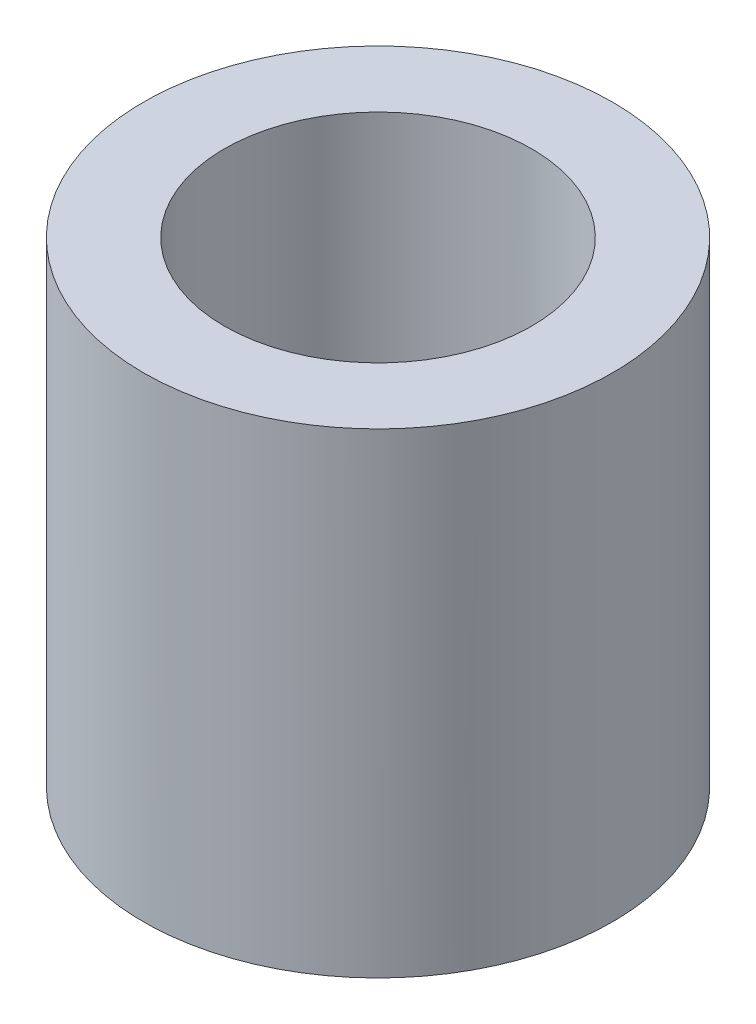
from build123d import *

# Parameters (mm, degrees)
SKETCH1_R           = 29
SKETCH1_R_2         = 19
BOSS_EXTRUDE1_DEPTH = 58.8
SKETCH2_R           = 10.45
CUT_EXTRUDE1_DEPTH  = 72.689887711


with BuildPart() as part:
    # Sketch1 → Boss-Extrude1 (new body)
    with BuildSketch(Plane(origin=(0, 0, 0), x_dir=(1, 0, 0), z_dir=(0, 1, 0))):
        with Locations(Location((0, 0, 0), (0, 0, 270))):
            Circle(SKETCH1_R)
        with Locations(Location((0, 0, 0), (0, 0, 270))):
            Circle(SKETCH1_R_2, mode=Mode.SUBTRACT)
    extrude(amount=BOSS_EXTRUDE1_DEPTH)

    # Sketch2 → Cut-Extrude1 (cut, through all)
    with BuildSketch(Plane.XY):
        Circle(SKETCH2_R)
    extrude(amount=-CUT_EXTRUDE1_DEPTH, mode=Mode.SUBTRACT)


solid = part.part
